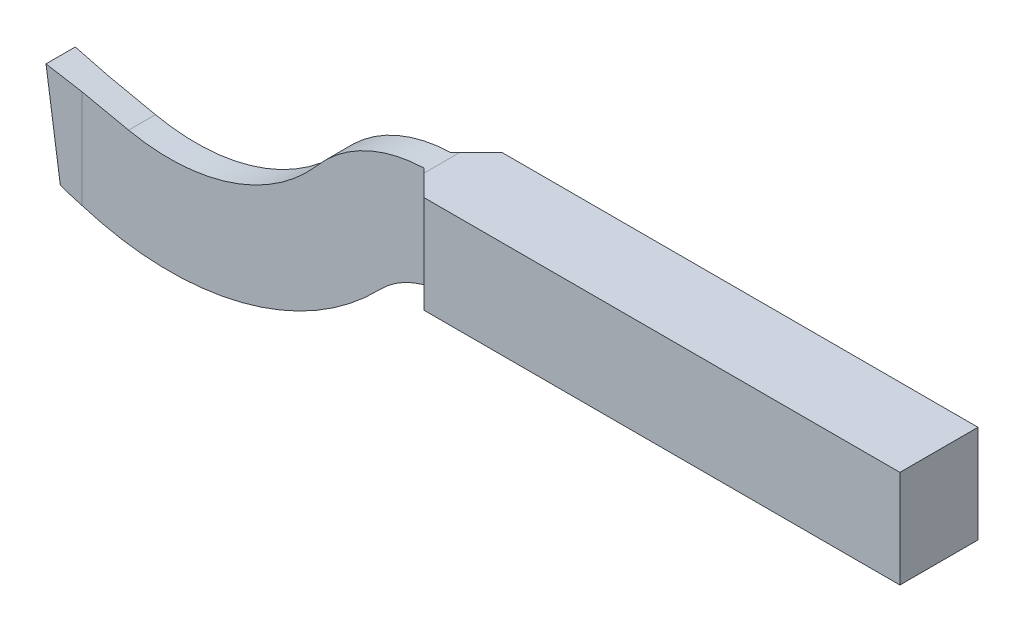
from build123d import *

# Parameters (mm, degrees)
BOSS_EXTRUDE1_DEPTH = 32
CUT_EXTRUDE1_DEPTH  = 373.178248616
CUT_EXTRUDE2_DEPTH  = 373.178248616


with BuildPart() as part:
    # Sketch1 → Boss-Extrude1 (new body)
    with BuildSketch(Plane.XY):
        with BuildLine():
            Line((0, 0), (5.6712054, -40.352723193))
            ThreePointArc((5.6712054, -40.352723193), (75.270905948, -46.149494531), (136.31057695, -12.210145124))
            ThreePointArc((136.31057695, -12.210145124), (149.453776515, -3.178849861), (165.080769267, 0))
            Line((165.080769267, 0), (360, 0))
            Line((360, 0), (360, 40))
            Line((360, 40), (156.254224553, 40))
            ThreePointArc((156.254224553, 40), (131.195287612, 34.51650832), (110.716699745, 19.068322645))
            ThreePointArc((110.716699745, 19.068322645), (75.630846168, -4.623558298), (33.367064735, -7.092388553))
            Line((33.367064735, -7.092388553), (0, 0))
        make_face()
    extrude(amount=BOSS_EXTRUDE1_DEPTH)

    # Sketch3 → Cut-Extrude1 (cut, through all)
    with BuildSketch(Plane(origin=(0, 40, 0), x_dir=(1, 0, 0), z_dir=(0, 1, 0))):
        Polygon((165, 0), (0, 0), (0, -10), (155, -10), align=None)
        Polygon((0, -32), (165, -32), (155, -22), (0, -22), align=None)
    extrude(amount=-CUT_EXTRUDE1_DEPTH, mode=Mode.SUBTRACT)

    # Sketch4 → Cut-Extrude2 (cut, through all)
    with BuildSketch(Plane(origin=(0, 40, 0), x_dir=(1, 0, 0), z_dir=(0, 1, 0))):
        Polygon((155, -10), (0, -10), (14.318126641, -10.5), (154.5, -10.5), align=None)
        Polygon((14.318126641, -21.5), (0, -22), (155, -22), (154.5, -21.5), align=None)
    extrude(amount=-CUT_EXTRUDE2_DEPTH, mode=Mode.SUBTRACT)


solid = part.part
